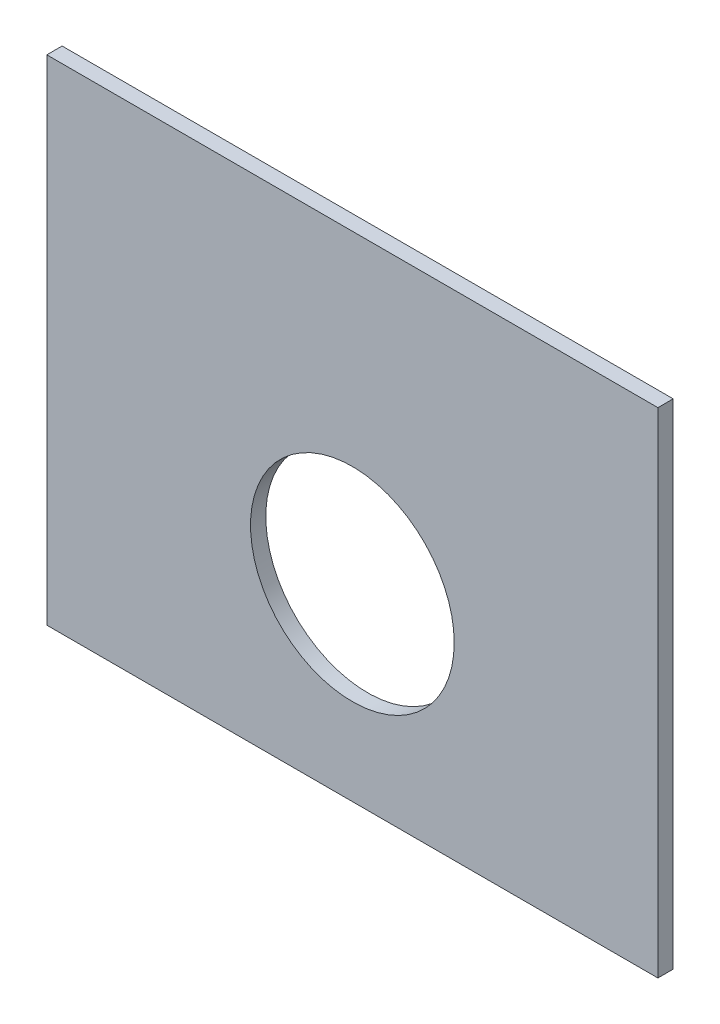
from build123d import *

# Parameters (mm, degrees)
ESBO_O1_W                = 120
ESBO_O1_H                = 97
RESSALTO_EXTRUS_O1_DEPTH = 3
ESBO_O2_R                = 20
CORTE_EXTRUS_O1_DEPTH    = 78.209131584


with BuildPart() as part:
    # Esboço1 → Ressalto-extrusão1 (new body)
    with BuildSketch(Plane.XY):
        Rectangle(ESBO_O1_W, ESBO_O1_H)
    extrude(amount=RESSALTO_EXTRUS_O1_DEPTH)

    # Esboço2 → Corte-extrusão1 (cut, through all)
    with BuildSketch(Plane.XY.offset(3)):
        with Locations((0, -11.5)):
            Circle(ESBO_O2_R)
    extrude(amount=-CORTE_EXTRUS_O1_DEPTH, mode=Mode.SUBTRACT)


solid = part.part
